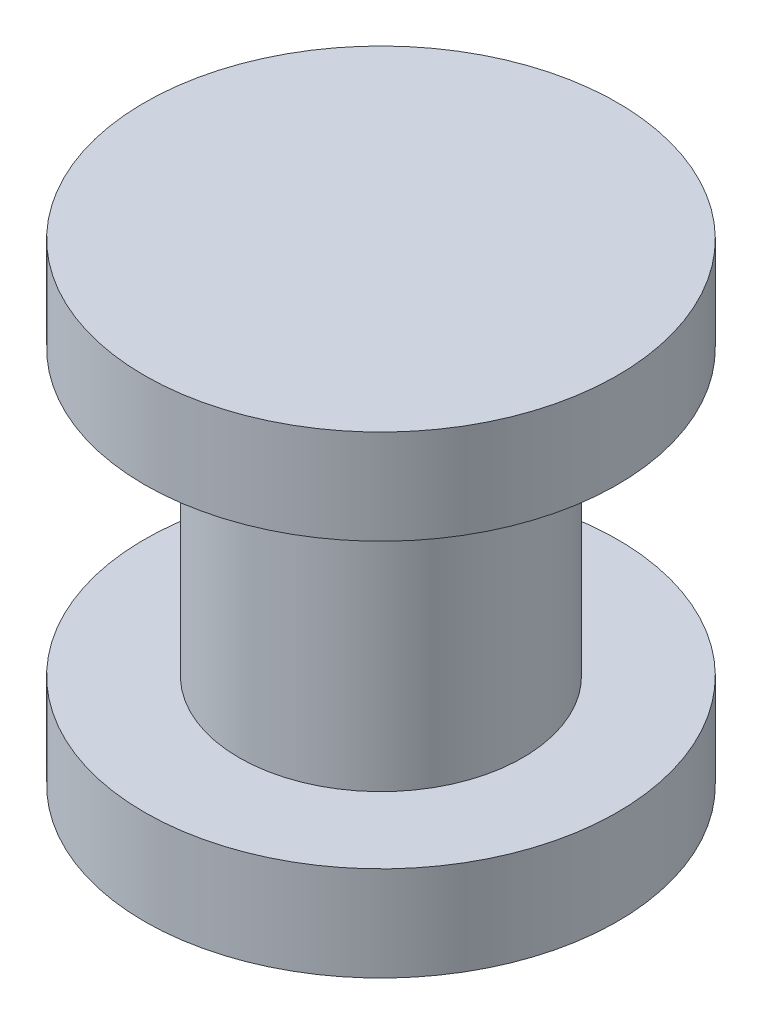
from build123d import *


with BuildPart() as part:
    # Sketch1 → Revolve1 (revolve)
    with BuildSketch(Plane.XY, mode=Mode.PRIVATE) as revolve1_sk:
        Polygon((-14.761543591, 24.948638362), (-17.261543591, 24.948638362), (-17.261543591, 23.948638362), (-16.261543591, 23.948638362), (-16.261543591, 20.948638362), (-17.261543591, 20.948638362), (-17.261543591, 19.948638362), (-14.761543591, 19.948638362), align=None)
    revolve(revolve1_sk.sketch.rotate(Axis((-14.761543591, 24.948638362, 0), (0, -1, 0)), 270), axis=Axis((-14.761543591, 24.948638362, 0), (0, -1, 0)))


solid = part.part
